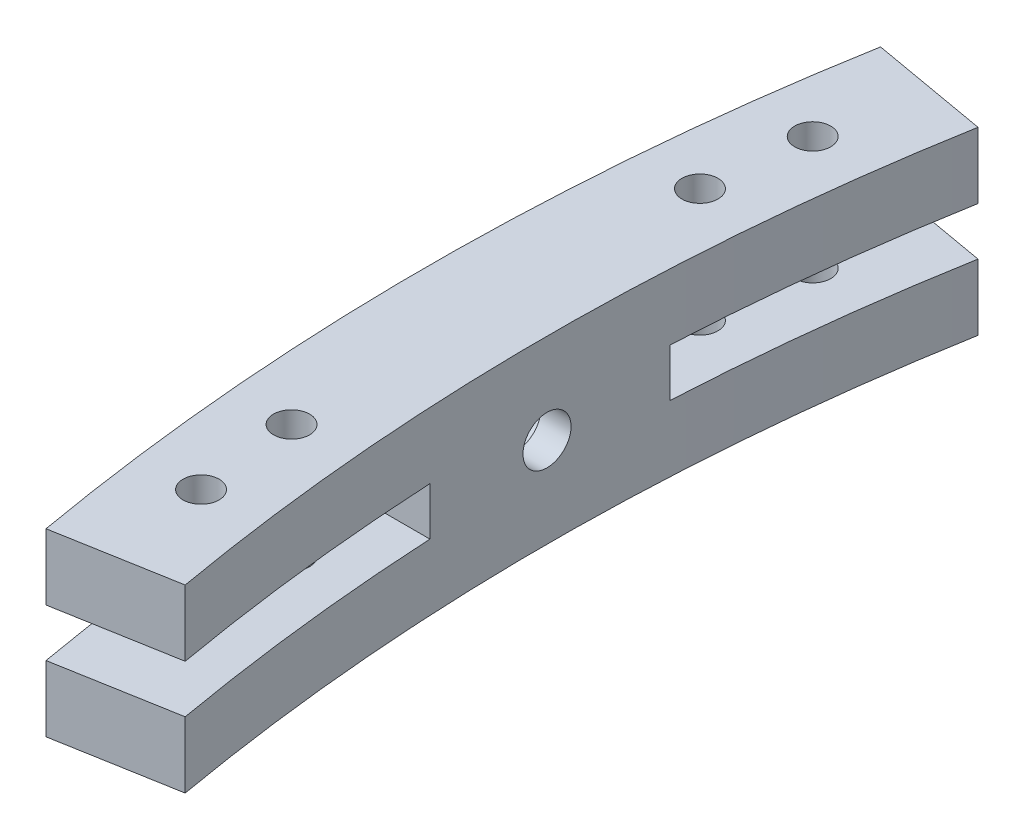
from build123d import *

# Parameters (mm, degrees)
BASE_DEPTH            = 7.5
MOUNT_START           = -2
MOUNT_DEPTH           = 4
MOUNT_HOLE_DEPTH      = 204.131478566
MOUNT_HOLE_DEPTH_BACK = 204.131478566
SKETCH12_R            = 1.5
SKETCH14_R            = 2
SHAFT_HOLE_DEPTH      = 37.394984425
SKETCH13_W            = 2.5
SKETCH13_H            = 3.5


with BuildPart() as part:
    # Sketch9 → base (new, symmetric)
    with BuildSketch(Plane(origin=(0, 0, 0), x_dir=(1, 0, 0), z_dir=(0, 1, 0))):
        with BuildLine():
            ThreePointArc((-187.113473072, -32.993153757), (-190, 0), (-187.113473072, 32.993153757))
            Line((-187.113473072, 32.993153757), (-196.961550602, 34.729635533))
            ThreePointArc((-196.961550602, 34.729635533), (-200, 0), (-196.961550602, -34.729635533))
            Line((-196.961550602, -34.729635533), (-187.113473072, -32.993153757))
        make_face()
    extrude(amount=BASE_DEPTH, both=True)

    # Sketch11 → mount (cut)
    with BuildSketch(Plane(origin=(0, 0, 0), x_dir=(1, 0, 0), z_dir=(0, 1, 0)).offset(MOUNT_START)):
        with BuildLine():
            Line((-189.73665961, -10), (-199.749843554, -10))
            ThreePointArc((-199.749843554, -10), (-198.7407137, -22.408228804), (-196.961550602, -34.729635533))
            Line((-196.961550602, -34.729635533), (-187.113473072, -32.993153757))
            ThreePointArc((-187.113473072, -32.993153757), (-188.775466906, -21.536552519), (-189.73665961, -10))
        make_face()
        with BuildLine():
            Line((-189.73665961, 10), (-199.749843554, 10))
            ThreePointArc((-199.749843554, 10), (-198.7407137, 22.408228804), (-196.961550602, 34.729635533))
            Line((-196.961550602, 34.729635533), (-187.113473072, 32.993153757))
            ThreePointArc((-187.113473072, 32.993153757), (-188.775466906, 21.536552519), (-189.73665961, 10))
        make_face()
    extrude(amount=MOUNT_DEPTH, mode=Mode.SUBTRACT)

    # Sketch12 → mount hole (cut, two sides: drawn at the far end of the back side and taken through both)
    with BuildSketch(Plane(origin=(0, 0, 0), x_dir=(1, 0, 0), z_dir=(0, 1, 0)).offset(-MOUNT_HOLE_DEPTH_BACK)):
        with Locations(Location((-193.331747968, 25.452607483, 0), (0, 0, 270))):
            Circle(SKETCH12_R)
        with Locations(Location((-194.257966128, 16.995369836, 0), (0, 0, 270))):
            Circle(SKETCH12_R)
        with Locations(Location((-194.257966128, -16.995369836, 0), (0, 0, 270))):
            Circle(SKETCH12_R)
        with Locations(Location((-193.331747968, -25.452607483, 0), (0, 0, 270))):
            Circle(SKETCH12_R)
    extrude(amount=MOUNT_HOLE_DEPTH + MOUNT_HOLE_DEPTH_BACK, mode=Mode.SUBTRACT)

    # Sketch14 → shaft hole (cut, through all)
    with BuildSketch(Plane.ZY.offset(195)):
        Circle(SKETCH14_R)
    extrude(amount=-SHAFT_HOLE_DEPTH, mode=Mode.SUBTRACT)

    # Sketch13 → Cut-Revolve1 (revolve, cut)
    with BuildSketch(Plane(origin=(0, 0, 0), x_dir=(1, 0, 0), z_dir=(0, 1, 0)), mode=Mode.PRIVATE) as cut_revolve1_sk:
        with Locations((-193.75, 1.75)):
            Rectangle(SKETCH13_W, SKETCH13_H)
    revolve(cut_revolve1_sk.sketch.rotate(Axis((0, 0, 0), (-1, 0, 0)), 180), axis=Axis((0, 0, 0), (-1, 0, 0)), mode=Mode.SUBTRACT)


solid = part.part
